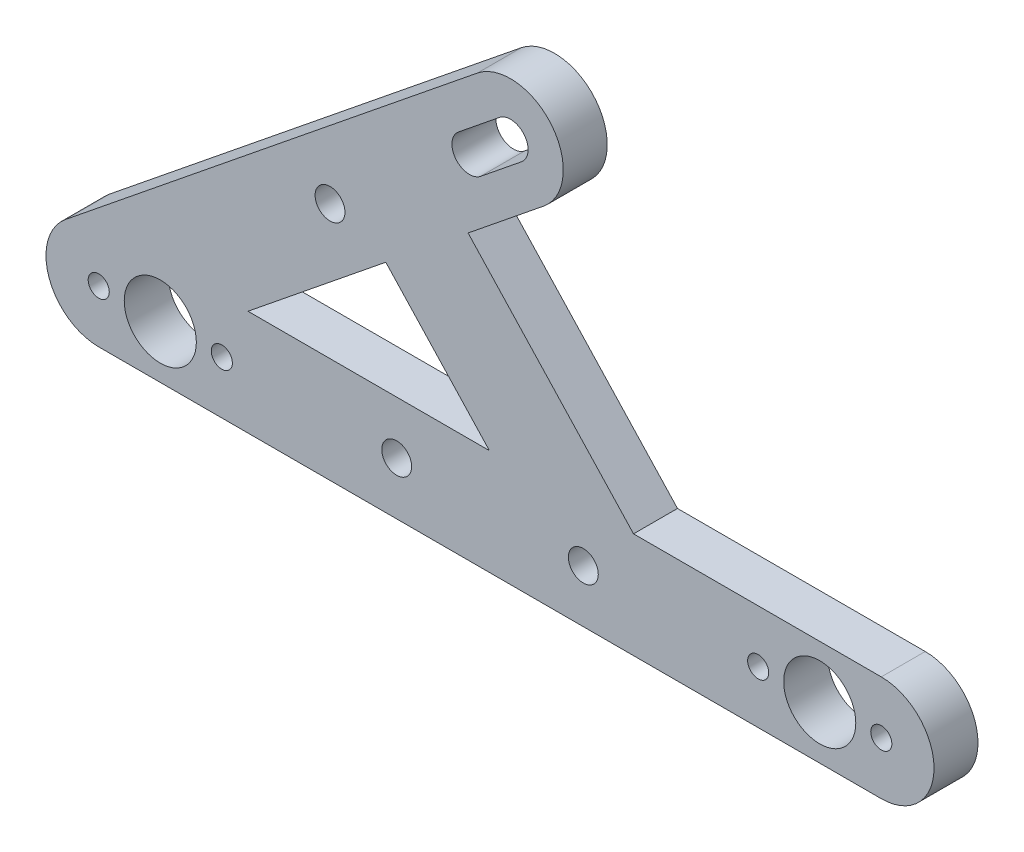
from build123d import *

# Parameters (mm, degrees)
BOSS_EXTRU_2_DEPTH   = 5
D_GAGEMENT_M21_D     = 2.4
D_GAGEMENT_M21_DEPTH = 10
D_GAGEMENT_M21_TIP   = 0.721032743
D_GAGEMENT_M81_D     = 8.2
D_GAGEMENT_M81_DEPTH = 10
D_GAGEMENT_M81_TIP   = 2.463528538
D_GAGEMENT_M22_D     = 2.4
D_GAGEMENT_M22_DEPTH = 10
D_GAGEMENT_M22_TIP   = 0.721032743
D_GAGEMENT_M82_D     = 8.2
D_GAGEMENT_M82_DEPTH = 10
D_GAGEMENT_M82_TIP   = 2.463528538
D_GAGEMENT_M31_D     = 3.4
D_GAGEMENT_M31_DEPTH = 5
D_GAGEMENT_M31_TIP   = 1.021463052


with BuildPart() as part:
    # Esquisse1 → Boss.-Extru.2 (new body)
    with BuildSketch(Plane.XY):
        with BuildLine():
            Line((-2.492714326, 26.224698366), (6.10421614, 33.170262072))
            ThreePointArc((6.10421614, 33.170262072), (7.000718602, 41.608051079), (-1.437070405, 42.504553542))
            Line((-1.437070405, 42.504553542), (-48.270643273, 4.667145735))
            ThreePointArc((-48.270643273, 4.667145735), (-50.15698128, -1.999640667), (-44.5, -6))
            Line((-44.5, -6), (44.5, -6))
            ThreePointArc((44.5, -6), (50.5, 0), (44.5, 6))
            Line((44.5, 6), (16.324378099, 6))
            Line((16.324378099, 6), (-2.492714326, 26.224698366))
        make_face()
        Polygon((-27.526006497, 6), (-0.066265486, 6), (-11.849799184, 18.664996768), align=None, mode=Mode.SUBTRACT)
        with BuildLine():
            ThreePointArc((-3.590453958, 35.622479779), (-3.889288112, 32.809883443), (-1.076691777, 32.511049289))
            Line((-1.076691777, 32.511049289), (3.590453958, 36.281692562))
            ThreePointArc((3.590453958, 36.281692562), (3.889288112, 39.094288898), (1.076691777, 39.393123052))
            Line((1.076691777, 39.393123052), (-3.590453958, 35.622479779))
        make_face(mode=Mode.SUBTRACT)
    extrude(amount=BOSS_EXTRU_2_DEPTH)

    # Dégagement M21
    with Locations(Plane(origin=(0, 0, 0), x_dir=(-1, 0, 0), z_dir=(0, 0, -1))):
        with Locations((44.5, 0), (30.5, 0)):
            Hole(D_GAGEMENT_M21_D / 2, depth=D_GAGEMENT_M21_DEPTH)
            with Locations((0, 0, -(D_GAGEMENT_M21_DEPTH + D_GAGEMENT_M21_TIP / 2))):  # 118° drill point
                Cone(0, D_GAGEMENT_M21_D / 2, D_GAGEMENT_M21_TIP, mode=Mode.SUBTRACT)

    # Dégagement M81
    with Locations(Plane(origin=(0, 0, 0), x_dir=(-1, 0, 0), z_dir=(0, 0, -1))):
        with Locations((37.5, 0)):
            Hole(D_GAGEMENT_M81_D / 2, depth=D_GAGEMENT_M81_DEPTH)
            with Locations((0, 0, -(D_GAGEMENT_M81_DEPTH + D_GAGEMENT_M81_TIP / 2))):  # 118° drill point
                Cone(0, D_GAGEMENT_M81_D / 2, D_GAGEMENT_M81_TIP, mode=Mode.SUBTRACT)

    # Dégagement M22
    with Locations(Plane(origin=(0, 0, 0), x_dir=(-1, 0, 0), z_dir=(0, 0, -1))):
        with Locations((-44.5, 0), (-30.5, 0)):
            Hole(D_GAGEMENT_M22_D / 2, depth=D_GAGEMENT_M22_DEPTH)
            with Locations((0, 0, -(D_GAGEMENT_M22_DEPTH + D_GAGEMENT_M22_TIP / 2))):  # 118° drill point
                Cone(0, D_GAGEMENT_M22_D / 2, D_GAGEMENT_M22_TIP, mode=Mode.SUBTRACT)

    # Dégagement M82
    with Locations(Plane.XY.offset(5)):
        with Locations((37.5, 0)):
            Hole(D_GAGEMENT_M82_D / 2, depth=D_GAGEMENT_M82_DEPTH)
            with Locations((0, 0, -(D_GAGEMENT_M82_DEPTH + D_GAGEMENT_M82_TIP / 2))):  # 118° drill point
                Cone(0, D_GAGEMENT_M82_D / 2, D_GAGEMENT_M82_TIP, mode=Mode.SUBTRACT)

    # Dégagement M31
    with Locations(Plane.XY.offset(5)):
        with Locations((-18.192282617, 21.254321849), (10.613248654, 0), (-10.613248654, 0)):
            Hole(D_GAGEMENT_M31_D / 2, depth=D_GAGEMENT_M31_DEPTH)
            with Locations((0, 0, -(D_GAGEMENT_M31_DEPTH + D_GAGEMENT_M31_TIP / 2))):  # 118° drill point
                Cone(0, D_GAGEMENT_M31_D / 2, D_GAGEMENT_M31_TIP, mode=Mode.SUBTRACT)


solid = part.part
